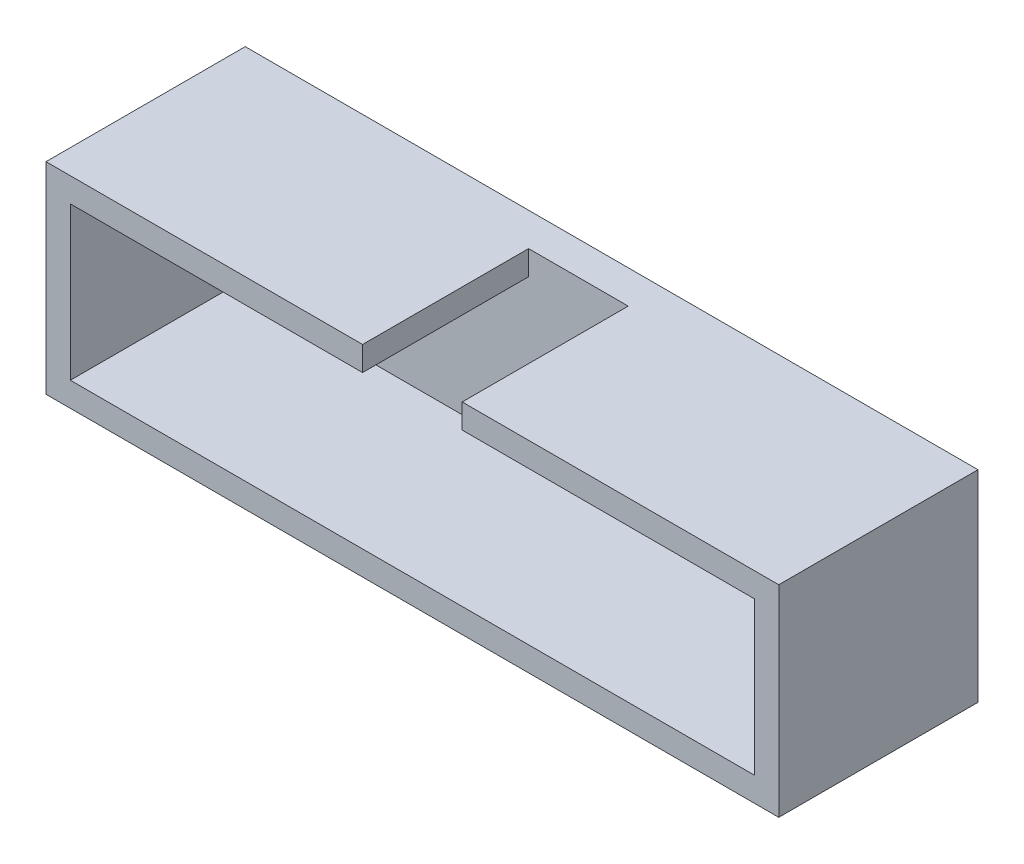
from build123d import *

# Parameters (mm, degrees)
SKETCH_2_W          = 33.1
SKETCH_2_H          = 9.1
EXTRUDE_1_DEPTH     = 9
SKETCH_3_W          = 30.9
SKETCH_3_H          = 6.9
CUT_EXTRUDE_1_DEPTH = 7.5
SKETCH_4_W          = 4.5
SKETCH_4_H          = 1.1
CUT_EXTRUDE_2_DEPTH = 7.5


with BuildPart() as part:
    # Эскиз2 → Бобышка-Вытянуть1 (new body)
    with BuildSketch(Plane.XY):
        Rectangle(SKETCH_2_W, SKETCH_2_H)
    extrude(amount=EXTRUDE_1_DEPTH)

    # Эскиз3 → Вырез-Вытянуть1 (cut)
    with BuildSketch(Plane.XY.offset(9)):
        Rectangle(SKETCH_3_W, SKETCH_3_H)
    extrude(amount=-CUT_EXTRUDE_1_DEPTH, mode=Mode.SUBTRACT)

    # Эскиз4 → Вырез-Вытянуть2 (cut)
    with BuildSketch(Plane.XY.offset(9)):
        with Locations((0, 4)):
            Rectangle(SKETCH_4_W, SKETCH_4_H)
    extrude(amount=-CUT_EXTRUDE_2_DEPTH, mode=Mode.SUBTRACT)


solid = part.part
